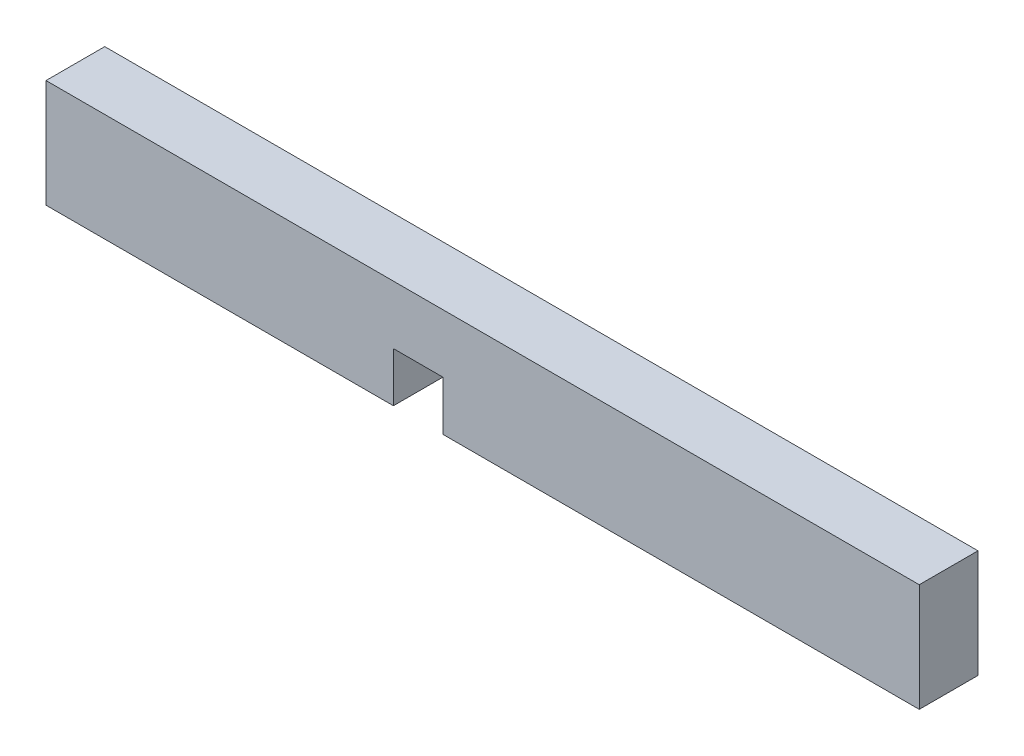
from build123d import *

# Parameters (mm, degrees)
BOSS_EXTRUDE1_DEPTH = 4.699


with BuildPart() as part:
    # Sketch1 → Boss-Extrude1 (new body)
    with BuildSketch(Plane.XY):
        Polygon((-3.9624, -3.9624), (-31.75, -3.9624), (-31.75, 4.6736), (38.1, 4.6736), (38.1, -3.9624), (0, -3.9624), (0, 0), (-3.9624, 0), align=None)
    extrude(amount=BOSS_EXTRUDE1_DEPTH)


solid = part.part
